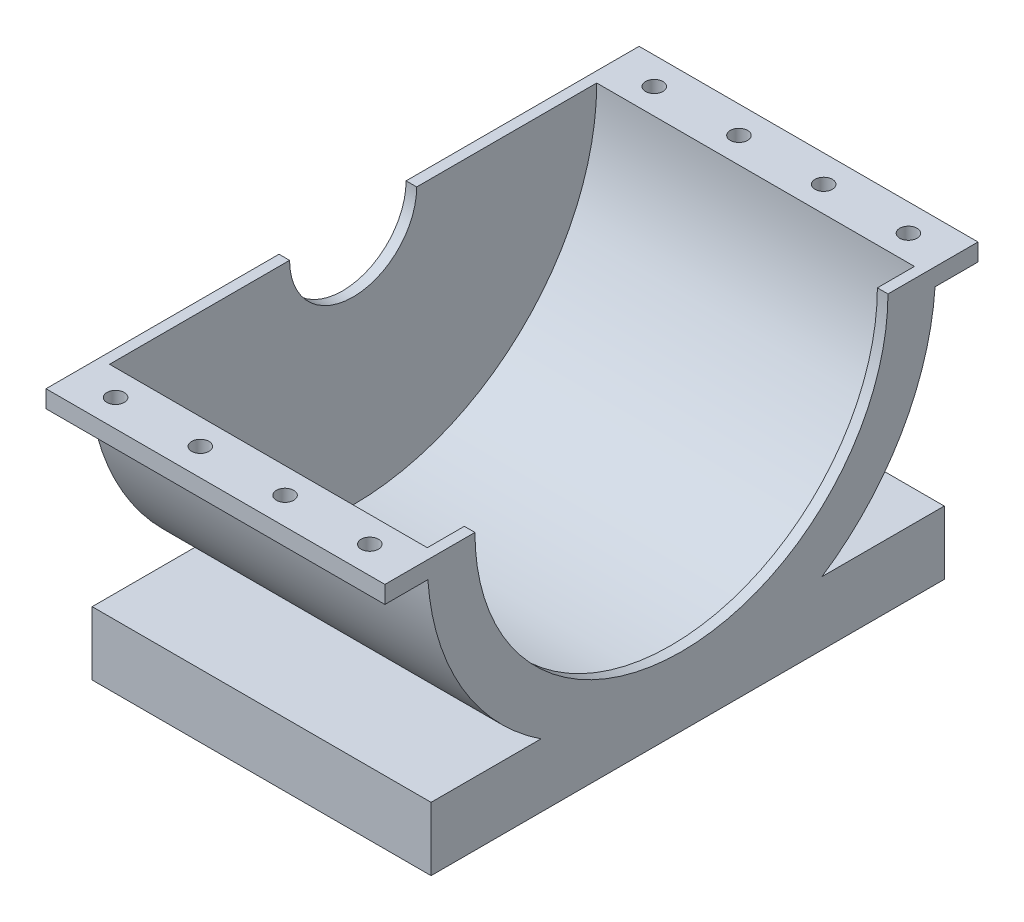
from build123d import *

# Parameters (mm, degrees)
BOSS_EXTRUDE1_DEPTH = 4
CUT_EXTRUDE1_DEPTH  = 3.75
CUT_EXTRUDE2_REACH  = 14.46
CUT_EXTRUDE3_REACH  = 14.301
CUT_EXTRUDE4_REACH  = 12.356
SKETCH6_R           = 0.205


with BuildPart() as part:
    # Sketch1 → Boss-Extrude1 (new, symmetric)
    with BuildSketch(Plane(origin=(0, 0, 0), x_dir=(0, 0, -1), z_dir=(1, 0, 0))):
        with BuildLine():
            Line((-7, 0), (7, 0))
            Line((7, 0), (7, -0.41))
            Line((7, -0.41), (5.985975276, -0.41))
            ThreePointArc((5.985975276, -0.41), (5.186676874, -3.016352599), (3.31662479, -5))
            Line((3.31662479, -5), (6.203592814, -5))
            Line((6.203592814, -5), (6.203592814, -6.5))
            Line((6.203592814, -6.5), (-5.910179641, -6.5))
            Line((-5.910179641, -6.5), (-5.910179641, -5))
            Line((-5.910179641, -5), (-3.31662479, -5))
            ThreePointArc((-3.31662479, -5), (-5.186676874, -3.016352599), (-5.985975276, -0.41))
            Line((-5.985975276, -0.41), (-7, -0.41))
            Line((-7, -0.41), (-7, 0))
        make_face()
    extrude(amount=BOSS_EXTRUDE1_DEPTH, both=True)

    # Sketch2 → Cut-Extrude1 (cut, symmetric)
    with BuildSketch(Plane(origin=(0, 0, 0), x_dir=(0, 0, -1), z_dir=(1, 0, 0))):
        with BuildLine():
            Line((-5.75, 0), (5.75, 0))
            ThreePointArc((5.75, 0), (0, -5.75), (-5.75, 0))
        make_face()
    extrude(amount=CUT_EXTRUDE1_DEPTH, both=True, mode=Mode.SUBTRACT)

    # Sketch3 → Cut-Extrude2 (cut, up to next)
    with BuildSketch(Plane(origin=(4, 0, 0), x_dir=(0, 0, -1), z_dir=(1, 0, 0)), mode=Mode.PRIVATE) as cut_extrude2_sk1:
        with BuildLine():
            Line((-4.875, 0), (4.875, 0))
            ThreePointArc((4.875, 0), (0, -4.875), (-4.875, 0))
        make_face()
    cut_extrude2_tool1 = extrude(cut_extrude2_sk1.sketch, amount=-CUT_EXTRUDE2_REACH, mode=Mode.PRIVATE) & part.part
    add(cut_extrude2_tool1.solids().sort_by_distance((4, -2.069014, 0))[0], mode=Mode.SUBTRACT)

    # Sketch4 → Cut-Extrude3 (cut, up to next)
    with BuildSketch(Plane(origin=(-3.75, 0, 0), x_dir=(0, 0, -1), z_dir=(1, 0, 0)), mode=Mode.PRIVATE) as cut_extrude3_sk1:
        with BuildLine():
            Line((-1.5, 0), (1.5, 0))
            ThreePointArc((1.5, 0), (0, -1.5), (-1.5, 0))
        make_face()
    cut_extrude3_tool1 = extrude(cut_extrude3_sk1.sketch, amount=-CUT_EXTRUDE3_REACH, mode=Mode.PRIVATE) & part.part
    add(cut_extrude3_tool1.solids().sort_by_distance((-3.75, -0.63662, 0))[0], mode=Mode.SUBTRACT)

    # Sketch6 → Cut-Extrude4 (cut, up to next)
    with BuildSketch(Plane(origin=(0, 0, 0), x_dir=(1, 0, 0), z_dir=(0, 1, 0)), mode=Mode.PRIVATE) as cut_extrude4_sk1:
        with Locations(Location((3, 6.357400892, 0), (0, 0, 270))):
            Circle(SKETCH6_R)
    cut_extrude4_tool1 = extrude(cut_extrude4_sk1.sketch, amount=-CUT_EXTRUDE4_REACH, mode=Mode.PRIVATE) & part.part
    # Sketch6 → Cut-Extrude4 (cut, up to next)
    with BuildSketch(Plane(origin=(0, 0, 0), x_dir=(1, 0, 0), z_dir=(0, 1, 0)), mode=Mode.PRIVATE) as cut_extrude4_sk2:
        with Locations(Location((1, 6.357400892, 0), (0, 0, 270))):
            Circle(SKETCH6_R)
    cut_extrude4_tool2 = extrude(cut_extrude4_sk2.sketch, amount=-CUT_EXTRUDE4_REACH, mode=Mode.PRIVATE) & part.part
    # Sketch6 → Cut-Extrude4 (cut, up to next)
    with BuildSketch(Plane(origin=(0, 0, 0), x_dir=(1, 0, 0), z_dir=(0, 1, 0)), mode=Mode.PRIVATE) as cut_extrude4_sk3:
        with Locations(Location((-1, 6.357400892, 0), (0, 0, 270))):
            Circle(SKETCH6_R)
    cut_extrude4_tool3 = extrude(cut_extrude4_sk3.sketch, amount=-CUT_EXTRUDE4_REACH, mode=Mode.PRIVATE) & part.part
    # Sketch6 → Cut-Extrude4 (cut, up to next)
    with BuildSketch(Plane(origin=(0, 0, 0), x_dir=(1, 0, 0), z_dir=(0, 1, 0)), mode=Mode.PRIVATE) as cut_extrude4_sk4:
        with Locations(Location((-3, 6.357400892, 0), (0, 0, 270))):
            Circle(SKETCH6_R)
    cut_extrude4_tool4 = extrude(cut_extrude4_sk4.sketch, amount=-CUT_EXTRUDE4_REACH, mode=Mode.PRIVATE) & part.part
    cut_extrude4_1 = cut_extrude4_tool1.solids().sort_by_distance((3, 0, -6.357401))[0]
    add(cut_extrude4_1, mode=Mode.SUBTRACT)
    cut_extrude4_2 = cut_extrude4_tool2.solids().sort_by_distance((1, 0, -6.357401))[0]
    add(cut_extrude4_2, mode=Mode.SUBTRACT)
    cut_extrude4_3 = cut_extrude4_tool3.solids().sort_by_distance((-1, 0, -6.357401))[0]
    add(cut_extrude4_3, mode=Mode.SUBTRACT)
    cut_extrude4_4 = cut_extrude4_tool4.solids().sort_by_distance((-3, 0, -6.357401))[0]
    add(cut_extrude4_4, mode=Mode.SUBTRACT)
    cut_extrude4 = cut_extrude4_1 + cut_extrude4_2 + cut_extrude4_3 + cut_extrude4_4  # Cut-Extrude4 as one shape, for the pattern or mirror that repeats it

    # Mirror1: Cut-Extrude4 across plane
    add(cut_extrude4.mirror(Plane.XY), mode=Mode.SUBTRACT)


solid = part.part
